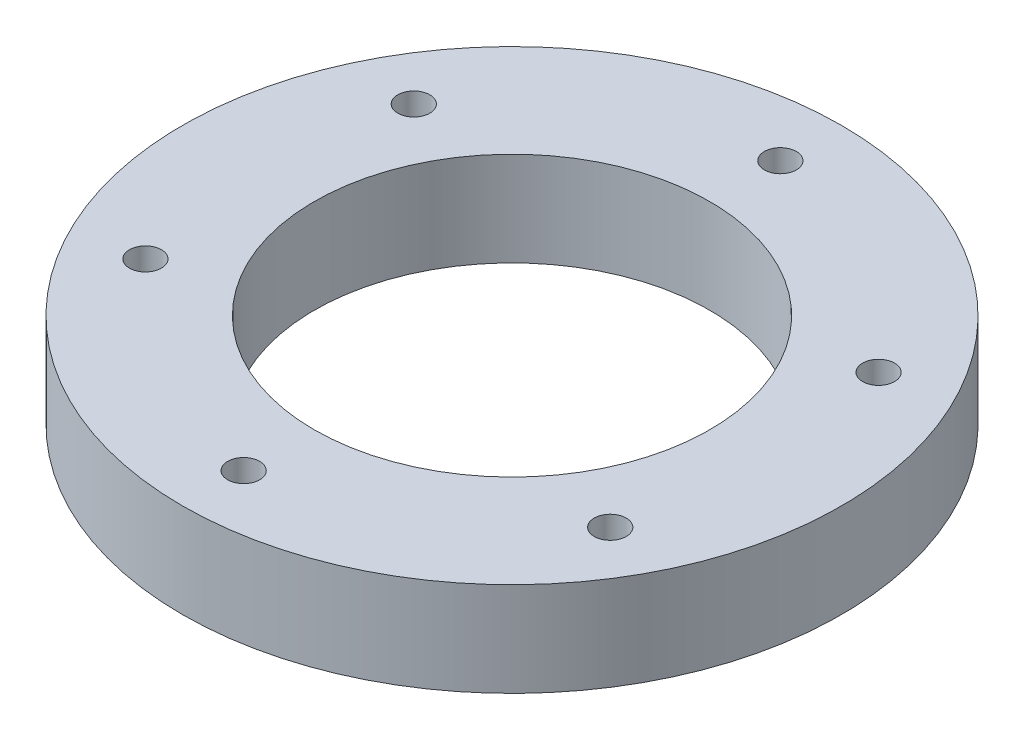
from build123d import *

# Parameters (mm, degrees)
SKETCH_1_R          = 35
SKETCH_1_R_2        = 21
EXTRUDE_1_DEPTH     = 10
SKETCH_2_R          = 1.7
CUT_EXTRUDE_1_DEPTH = 10


with BuildPart() as part:
    # 草图1 → 凸台-拉伸1 (new body)
    with BuildSketch(Plane(origin=(0, 0, 0), x_dir=(1, 0, 0), z_dir=(0, 1, 0))):
        with Locations(Location((0, 0, 0), (0, 0, 270))):
            Circle(SKETCH_1_R)
        with Locations(Location((0, 0, 0), (0, 0, 270))):
            Circle(SKETCH_1_R_2, mode=Mode.SUBTRACT)
    extrude(amount=EXTRUDE_1_DEPTH)

    # 草图2 → 切除-拉伸1 (cut)
    with BuildSketch(Plane(origin=(0, 10, 0), x_dir=(1, 0, 0), z_dir=(0, 1, 0))):
        with Locations(Location((0, 28.5, 0), (0, 0, 270))):
            Circle(SKETCH_2_R)
        with Locations(Location((24.681724008, 14.25, 0), (0, 0, 270))):
            Circle(SKETCH_2_R)
        with Locations(Location((24.681724008, -14.25, 0), (0, 0, 270))):
            Circle(SKETCH_2_R)
        with Locations(Location((0, -28.5, 0), (0, 0, 270))):
            Circle(SKETCH_2_R)
        with Locations(Location((-24.681724008, -14.25, 0), (0, 0, 270))):
            Circle(SKETCH_2_R)
        with Locations(Location((-24.681724008, 14.25, 0), (0, 0, 270))):
            Circle(SKETCH_2_R)
    extrude(amount=-CUT_EXTRUDE_1_DEPTH, mode=Mode.SUBTRACT)


solid = part.part
